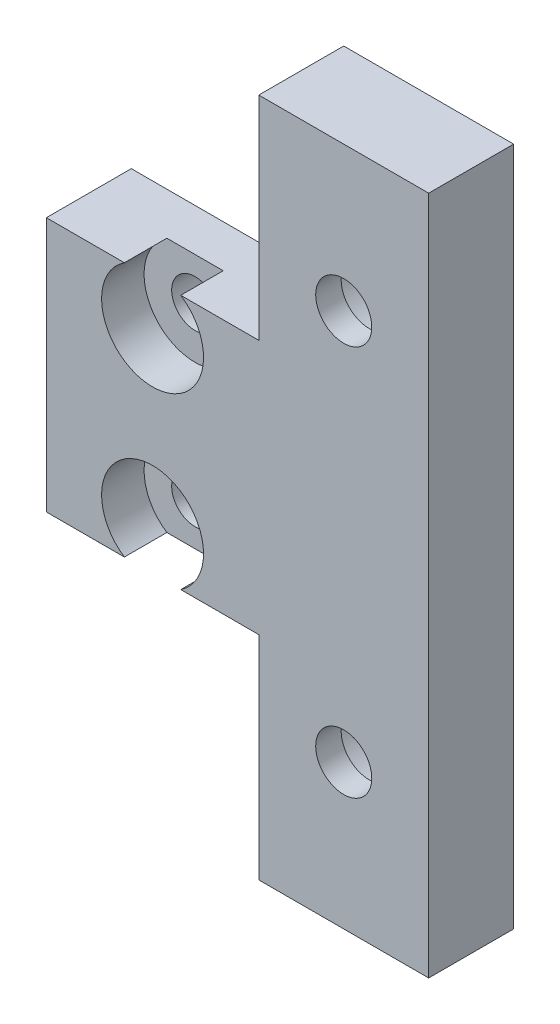
from build123d import *

# Parameters (mm, degrees)
ESQUISSE1_R             = 3.3
ESQUISSE1_R_2           = 2.75
BOSS_EXTRU_1_DEPTH      = 10
ESQUISSE2_R             = 6
ENL_V_MAT_EXTRU_1_DEPTH = 5
ESQUISSE3_R             = 7
ENL_V_MAT_EXTRU_3_DEPTH = 7


with BuildPart() as part:
    # Esquisse1 → Boss.-Extru.1 (new body)
    with BuildSketch(Plane.XY):
        Polygon((8.835664484, 27.89983396), (8.835664484, -52.10016604), (-11.164335516, -52.10016604), (-11.164335516, -27.10016604), (-36.164335516, -27.10016604), (-36.164335516, 2.89983396), (-11.164335516, 2.89983396), (-11.164335516, 27.89983396), align=None)
        with Locations((-1.164335516, 10.89983396)):
            Circle(ESQUISSE1_R, mode=Mode.SUBTRACT)
        with Locations((-1.164335516, -35.10016604)):
            Circle(ESQUISSE1_R, mode=Mode.SUBTRACT)
        with Locations((-23.664335516, -2.10016604)):
            Circle(ESQUISSE1_R_2, mode=Mode.SUBTRACT)
        with Locations((-23.664335516, -22.10016604)):
            Circle(ESQUISSE1_R_2, mode=Mode.SUBTRACT)
    extrude(amount=BOSS_EXTRU_1_DEPTH)

    # Esquisse2 → Enlèv. mat.-Extru.1 (cut)
    with BuildSketch(Plane.XY.offset(10)):
        with Locations((-23.664335516, -2.10016604)):
            Circle(ESQUISSE2_R)
        with Locations((-23.664335516, -22.10016604)):
            Circle(ESQUISSE2_R)
    extrude(amount=-ENL_V_MAT_EXTRU_1_DEPTH, mode=Mode.SUBTRACT)

    # Esquisse3 → Enlèv. mat.-Extru.3 (cut)
    with BuildSketch(Plane(origin=(0, 0, 0), x_dir=(-1, 0, 0), z_dir=(0, 0, -1))):
        with Locations((1.164335516, 10.89983396)):
            Circle(ESQUISSE3_R)
        with Locations((1.164335516, -35.10016604)):
            Circle(ESQUISSE3_R)
    extrude(amount=-ENL_V_MAT_EXTRU_3_DEPTH, mode=Mode.SUBTRACT)


solid = part.part
